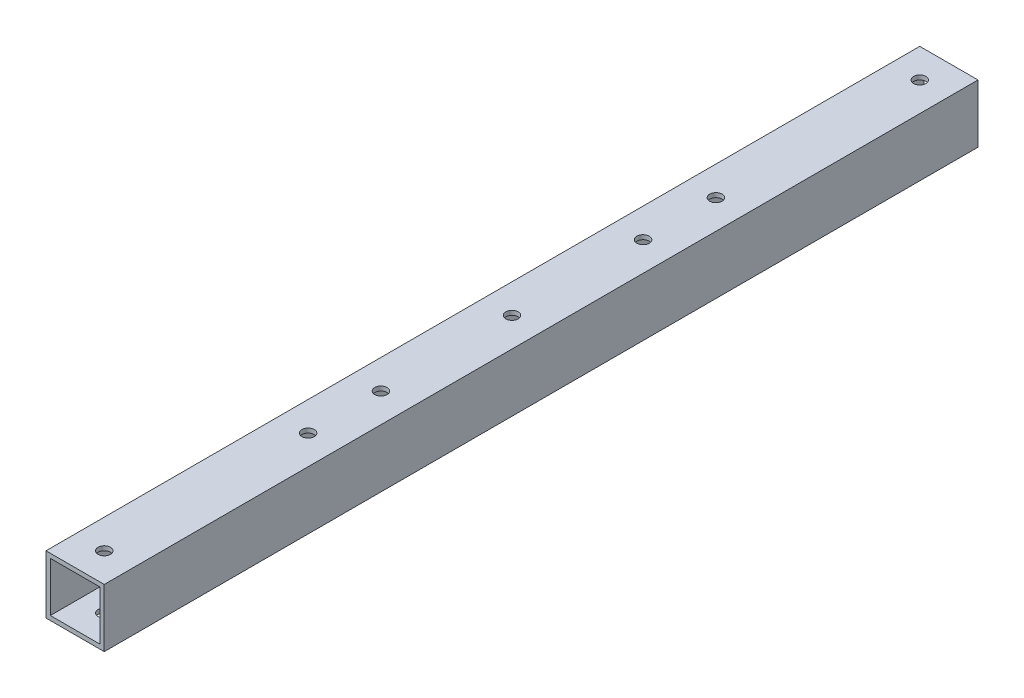
from build123d import *

# Parameters (mm, degrees)
SKETCH1_W           = 20
SKETCH1_H           = 20
SKETCH1_W_2         = 17
SKETCH1_H_2         = 17
BOSS_EXTRUDE1_DEPTH = 300
SKETCH2_R           = 2.125
CUT_EXTRUDE1_DEPTH  = 301.83217913


with BuildPart() as part:
    # Sketch1 → Boss-Extrude1 (new body)
    with BuildSketch(Plane.XY):
        Rectangle(SKETCH1_W, SKETCH1_H)
        Rectangle(SKETCH1_W_2, SKETCH1_H_2, mode=Mode.SUBTRACT)
    extrude(amount=-BOSS_EXTRUDE1_DEPTH)

    # Sketch2 → Cut-Extrude1 (cut, through all)
    with BuildSketch(Plane(origin=(0, 10, 0), x_dir=(1, 0, 0), z_dir=(0, 1, 0))):
        with Locations(Location((0, 10, 0), (0, 0, 270))):
            Circle(SKETCH2_R)
        with Locations(Location((0, 80, 0), (0, 0, 270))):
            Circle(SKETCH2_R)
        with Locations(Location((0, 150, 0), (0, 0, 270))):
            Circle(SKETCH2_R)
        with Locations(Location((0, 220, 0), (0, 0, 270))):
            Circle(SKETCH2_R)
        with Locations(Location((0, 290, 0), (0, 0, 270))):
            Circle(SKETCH2_R)
        with Locations(Location((0, 195, 0), (0, 0, 270))):
            Circle(SKETCH2_R)
        with Locations(Location((0, 105, 0), (0, 0, 90))):
            Circle(SKETCH2_R)
    extrude(amount=-CUT_EXTRUDE1_DEPTH, mode=Mode.SUBTRACT)


solid = part.part
